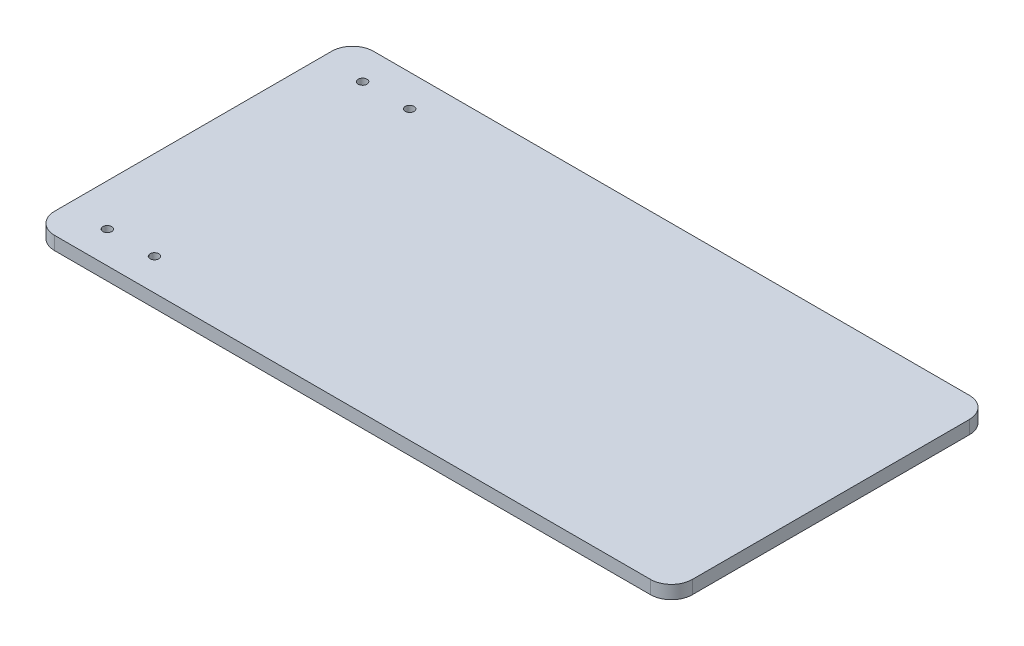
from build123d import *

# Parameters (mm, degrees)
SKETCH1_W           = 304.8
SKETCH1_H           = 152.4
BOSS_EXTRUDE1_DEPTH = 6.35
FILLET1_R           = 10
M5_TAPPED_HOLE1_D   = 4.2


with BuildPart() as part:
    # Sketch1 → Boss-Extrude1 (new body)
    with BuildSketch(Plane(origin=(0, 0, 0), x_dir=(1, 0, 0), z_dir=(0, 1, 0))):
        Rectangle(SKETCH1_W, SKETCH1_H)
    extrude(amount=BOSS_EXTRUDE1_DEPTH)

    # Fillet1
    fillet1_edges = [part.edges().sort_by_distance(p)[0] for p in [
        (-152.4, 3.175, -76.2),
        (152.4, 3.175, -76.2),
        (152.4, 3.175, 76.2),
        (-152.4, 3.175, 76.2),
    ]]
    fillet(fillet1_edges, radius=FILLET1_R)

    # M5 Tapped Hole1 (through all)
    with Locations(Plane(origin=(0, 6.35, 0), x_dir=(1, 0, 0), z_dir=(0, 1, 0))):
        with Locations((-132.4, -61), (-132.4, 61), (-109.9, 61), (-109.9, -61)):
            Hole(M5_TAPPED_HOLE1_D / 2)


solid = part.part
